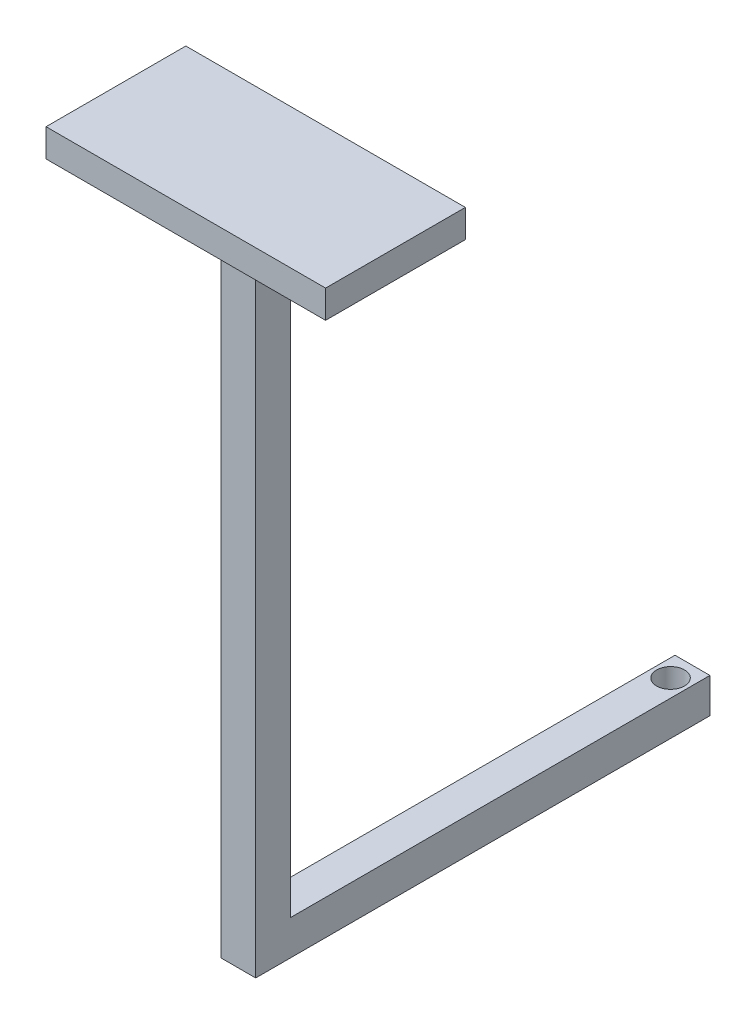
from build123d import *

# Parameters (mm, degrees)
ESQUISSE1_W             = 200
ESQUISSE1_H             = 100
BOSS_EXTRU_1_DEPTH      = 20
ESQUISSE2_W             = 25
ESQUISSE2_H             = 25
BOSS_EXTRU_2_DEPTH      = 470
ESQUISSE6_W             = 25
ESQUISSE6_H             = 25
BOSS_EXTRU_3_DEPTH      = 300
ESQUISSE9_R             = 10
ENL_V_MAT_EXTRU_1_DEPTH = 30


with BuildPart() as part:
    # Esquisse1 → Boss.-Extru.1 (new body)
    with BuildSketch(Plane(origin=(0, 0, 0), x_dir=(1, 0, 0), z_dir=(0, 1, 0))):
        Rectangle(ESQUISSE1_W, ESQUISSE1_H)
    extrude(amount=BOSS_EXTRU_1_DEPTH)

    # Esquisse2 → Boss.-Extru.2 (add)
    with BuildSketch(Plane(origin=(0, 0, 0), x_dir=(1, 0, 0), z_dir=(0, 1, 0))):
        Rectangle(ESQUISSE2_W, ESQUISSE2_H)
    extrude(amount=-BOSS_EXTRU_2_DEPTH)

    # Esquisse6 → Boss.-Extru.3 (add)
    with BuildSketch(Plane(origin=(0, 0, -12.5), x_dir=(-1, 0, 0), z_dir=(0, 0, -1))):
        with Locations((0, -457.5)):
            Rectangle(ESQUISSE6_W, ESQUISSE6_H)
    extrude(amount=BOSS_EXTRU_3_DEPTH)

    # Esquisse9 → Enlèv. mat.-Extru.1 (cut)
    with BuildSketch(Plane(origin=(0, -445, 0), x_dir=(1, 0, 0), z_dir=(0, 1, 0))):
        with Locations(Location((0, 296.828421152, 0), (0, 0, 270))):
            Circle(ESQUISSE9_R)
    extrude(amount=-ENL_V_MAT_EXTRU_1_DEPTH, mode=Mode.SUBTRACT)


solid = part.part
